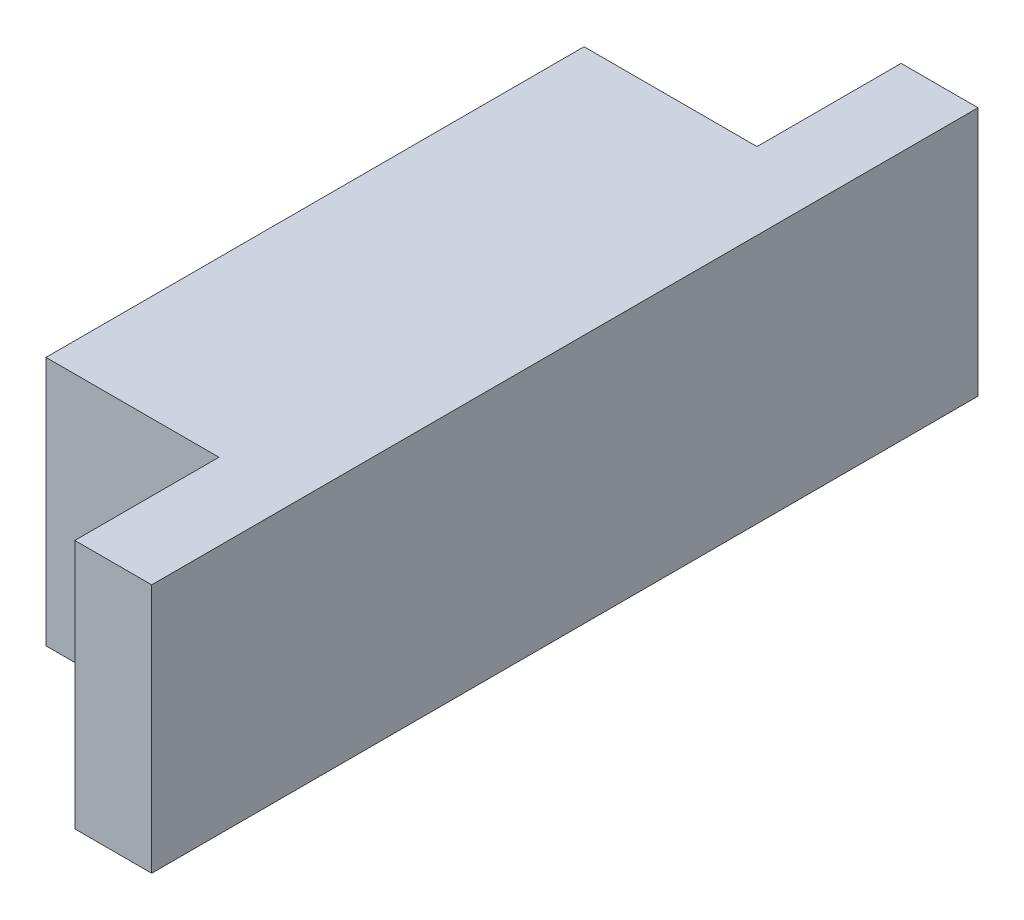
from build123d import *

# Parameters (mm, degrees)
CROQUIS1_W              = 28
CROQUIS1_H              = 13
SALIENTE_EXTRUIR1_DEPTH = 9
CROQUIS2_W              = 43
CROQUIS2_H              = 13
SALIENTE_EXTRUIR2_DEPTH = 4


with BuildPart() as part:
    # Croquis1 → Saliente-Extruir1 (new body)
    with BuildSketch(Plane(origin=(0, 0, 0), x_dir=(0, 0, -1), z_dir=(1, 0, 0))):
        with Locations((14, 6.5)):
            Rectangle(CROQUIS1_W, CROQUIS1_H)
    extrude(amount=SALIENTE_EXTRUIR1_DEPTH)

    # Croquis2 → Saliente-Extruir2 (add)
    with BuildSketch(Plane(origin=(9, 0, 0), x_dir=(0, 0, -1), z_dir=(1, 0, 0))):
        with Locations((14, 6.5)):
            Rectangle(CROQUIS2_W, CROQUIS2_H)
    extrude(amount=SALIENTE_EXTRUIR2_DEPTH)


solid = part.part
